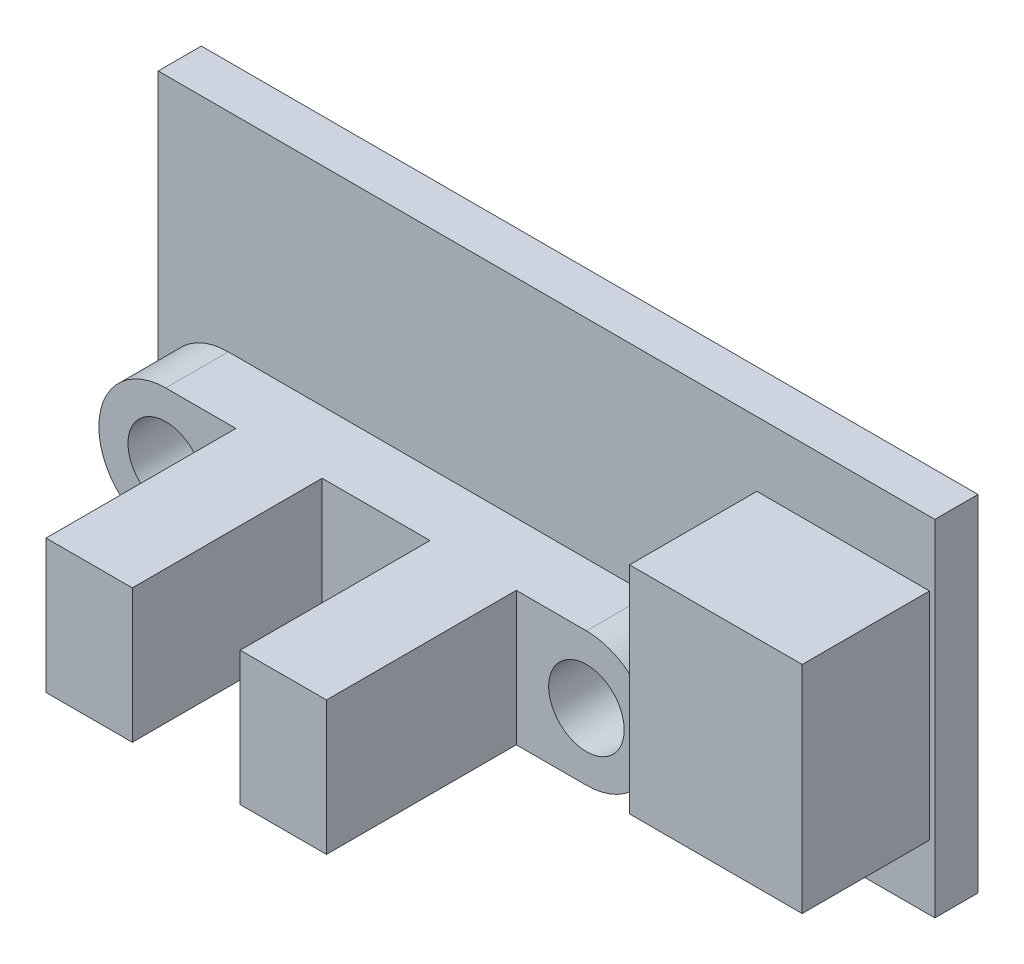
from build123d import *

# Parameters (mm, degrees)
SKETCH_1_W          = 36
SKETCH_1_H          = 16
EXTRUDE_1_DEPTH     = 2
EXTRUDE_2_DEPTH     = 2.9
SKETCH_3_W          = 4
SKETCH_3_H          = 6.2
EXTRUDE_3_DEPTH     = 8.8
SKETCH_4_W          = 8
SKETCH_4_H          = 10
EXTRUDE_4_DEPTH     = 5.9
SKETCH_5_R          = 1.75
CUT_EXTRUDE_1_DEPTH = 41.366322597


with BuildPart() as part:
    # Эскиз1 → Бобышка-Вытянуть1 (new body)
    with BuildSketch(Plane.XY):
        with Locations((18, -8)):
            Rectangle(SKETCH_1_W, SKETCH_1_H)
    extrude(amount=EXTRUDE_1_DEPTH)

    # Эскиз2 → Бобышка-Вытянуть2 (add)
    with BuildSketch(Plane.XY.offset(2)):
        with BuildLine():
            Line((3.25, -9.65), (22.75, -9.65))
            ThreePointArc((22.75, -9.65), (25.85, -12.75), (22.75, -15.85))
            Line((22.75, -15.85), (3.25, -15.85))
            ThreePointArc((3.25, -15.85), (0.15, -12.75), (3.25, -9.65))
        make_face()
    extrude(amount=EXTRUDE_2_DEPTH)

    # Эскиз3 → Бобышка-Вытянуть3 (add)
    with BuildSketch(Plane.XY.offset(4.9)):
        with Locations((8.5, -12.75)):
            Rectangle(SKETCH_3_W, SKETCH_3_H)
        with Locations((17.5, -12.75)):
            Rectangle(SKETCH_3_W, SKETCH_3_H)
    extrude(amount=EXTRUDE_3_DEPTH)

    # Эскиз4 → Бобышка-Вытянуть4 (add)
    with BuildSketch(Plane.XY.offset(2)):
        with Locations((31.75, -8)):
            Rectangle(SKETCH_4_W, SKETCH_4_H)
    extrude(amount=EXTRUDE_4_DEPTH)

    # Эскиз5 → Вырез-Вытянуть1 (cut, through all)
    with BuildSketch(Plane.XY.offset(4.9)):
        with Locations((3.25, -12.75)):
            Circle(SKETCH_5_R)
        with Locations((22.75, -12.75)):
            Circle(SKETCH_5_R)
    extrude(amount=-CUT_EXTRUDE_1_DEPTH, mode=Mode.SUBTRACT)


solid = part.part
